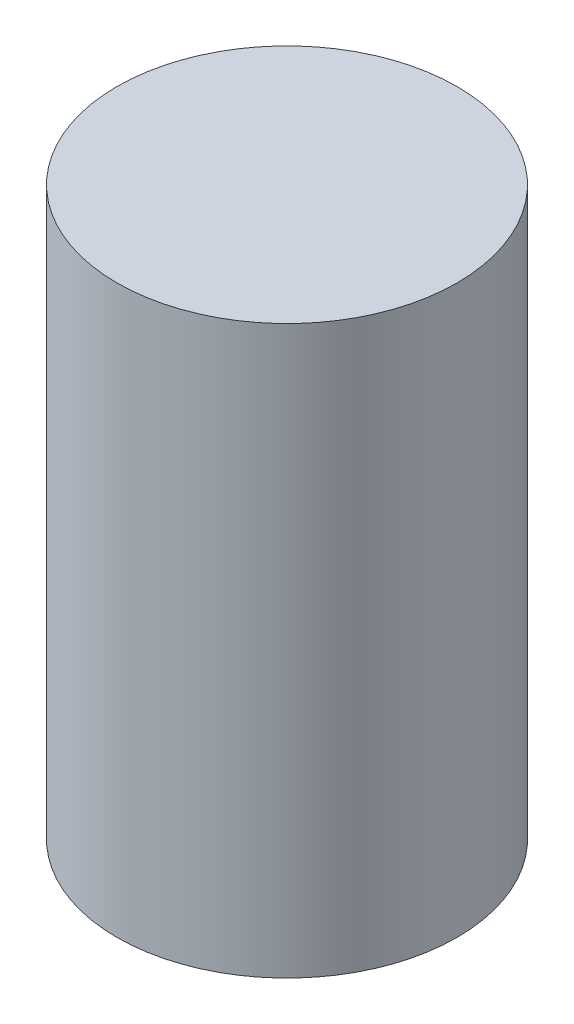
from build123d import *

# Parameters (mm, degrees)
SKETCH1_R           = 30
BOSS_EXTRUDE1_DEPTH = 100
SKETCH2_R           = 10
SKETCH2_R_2         = 5
CUT_EXTRUDE1_DEPTH  = 20


with BuildPart() as part:
    # Sketch1 → Boss-Extrude1 (new body)
    with BuildSketch(Plane(origin=(0, 0, 0), x_dir=(1, 0, 0), z_dir=(0, 1, 0))):
        with Locations(Location((0, 0, 0), (0, 0, 270))):
            Circle(SKETCH1_R)
    extrude(amount=BOSS_EXTRUDE1_DEPTH)

    # Sketch2 → Cut-Extrude1 (cut)
    with BuildSketch(Plane.XZ):
        with Locations(Location((0, 0, 0), (0, 0, 270))):
            Circle(SKETCH2_R)
        with Locations(Location((0, 22, 0), (0, 0, 270))):
            Circle(SKETCH2_R_2)
        with Locations(Location((0, -22, 0), (0, 0, 270))):
            Circle(SKETCH2_R_2)
    extrude(amount=-CUT_EXTRUDE1_DEPTH, mode=Mode.SUBTRACT)


solid = part.part
